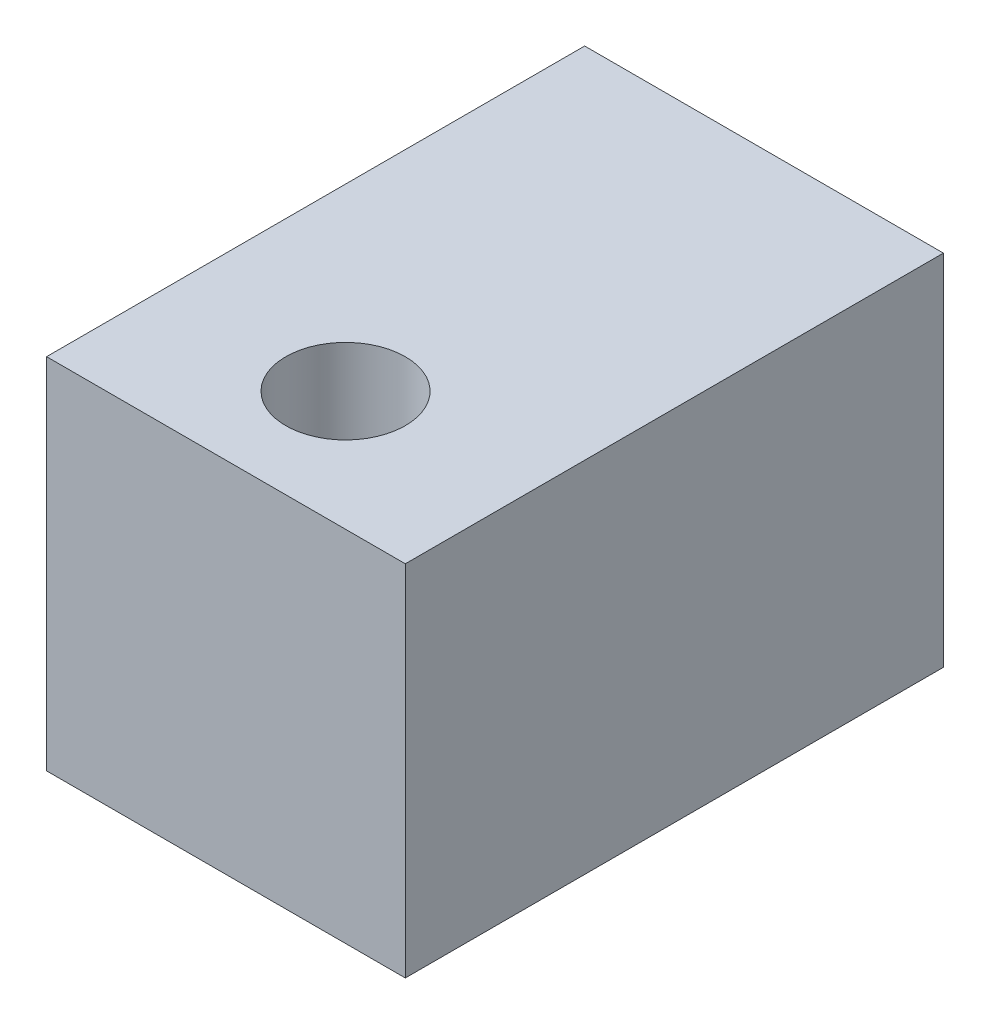
from build123d import *

# Parameters (mm, degrees)
SKETCH_1_W          = 12
SKETCH_1_H          = 12
SKETCH_1_W_2        = 10
SKETCH_1_H_2        = 10
EXTRUDE_1_DEPTH     = 10
SKETCH_2_W          = 12
SKETCH_2_H          = 12
EXTRUDE_2_DEPTH     = 8
SKETCH_3_R          = 2
CUT_EXTRUDE_3_DEPTH = 12


with BuildPart() as part:
    # 草图1 → 凸台-拉伸1 (new body)
    with BuildSketch(Plane.XY):
        with Locations((6, 6)):
            Rectangle(SKETCH_1_W, SKETCH_1_H)
        with Locations((6, 6)):
            Rectangle(SKETCH_1_W_2, SKETCH_1_H_2, mode=Mode.SUBTRACT)
    extrude(amount=EXTRUDE_1_DEPTH)

    # 草图2 → 凸台-拉伸2 (add)
    with BuildSketch(Plane.XY.offset(10)):
        with Locations((6, 6)):
            Rectangle(SKETCH_2_W, SKETCH_2_H)
    extrude(amount=EXTRUDE_2_DEPTH)

    # 草图3 → 切除-拉伸3 (cut)
    with BuildSketch(Plane(origin=(0, 0, 0), x_dir=(-1, 0, 0), z_dir=(0, -1, 0))):
        with Locations(Location((-6, -14, 0), (0, 0, 90))):
            Circle(SKETCH_3_R)
    extrude(amount=-CUT_EXTRUDE_3_DEPTH, mode=Mode.SUBTRACT)


solid = part.part
